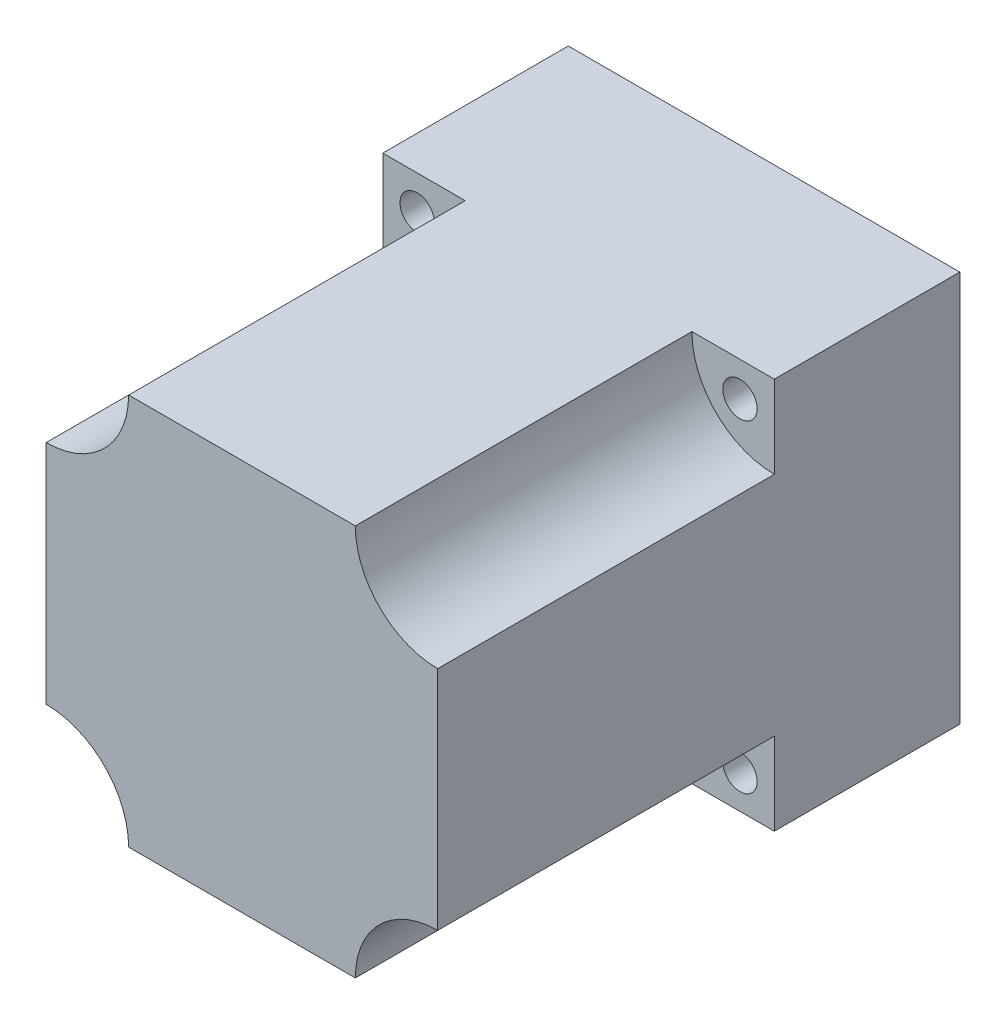
from build123d import *

# Parameters (mm, degrees)
SKETCH_1_W          = 57
SKETCH_1_H          = 57
EXTRUDE_1_DEPTH     = 76
SKETCH_2_R          = 12
CUT_EXTRUDE_1_DEPTH = 49
SKETCH_3_R          = 2.5
CUT_EXTRUDE_2_DEPTH = 87.026158812
SKETCH_4_R          = 19
EXTRUDE_2_DEPTH     = 1.6
SKETCH_5_R          = 4
EXTRUDE_3_DEPTH     = 18.4
SKETCH_6_W          = 13.034699884
SKETCH_6_H          = 1
CUT_EXTRUDE_3_DEPTH = 15


with BuildPart() as part:
    # 草图1 → 凸台-拉伸1 (new body)
    with BuildSketch(Plane.XY):
        Rectangle(SKETCH_1_W, SKETCH_1_H)
    extrude(amount=EXTRUDE_1_DEPTH)

    # 草图2 → 切除-拉伸1 (cut)
    with BuildSketch(Plane.XY.offset(76)):
        with Locations((-28.5, 28.5)):
            Circle(SKETCH_2_R)
        with Locations((28.5, 28.5)):
            Circle(SKETCH_2_R)
        with Locations((-28.5, -28.5)):
            Circle(SKETCH_2_R)
        with Locations((28.5, -28.5)):
            Circle(SKETCH_2_R)
    extrude(amount=-CUT_EXTRUDE_1_DEPTH, mode=Mode.SUBTRACT)

    # 草图3 → 切除-拉伸2 (cut, through all)
    with BuildSketch(Plane(origin=(0, 0, 0), x_dir=(-1, 0, 0), z_dir=(0, 0, -1))):
        with Locations((-23.5, 23.5)):
            Circle(SKETCH_3_R)
        with Locations((23.5, 23.5)):
            Circle(SKETCH_3_R)
        with Locations((-23.5, -23.5)):
            Circle(SKETCH_3_R)
        with Locations((23.5, -23.5)):
            Circle(SKETCH_3_R)
    extrude(amount=-CUT_EXTRUDE_2_DEPTH, mode=Mode.SUBTRACT)

    # 草图4 → 凸台-拉伸2 (add)
    with BuildSketch(Plane(origin=(0, 0, 0), x_dir=(-1, 0, 0), z_dir=(0, 0, -1))):
        Circle(SKETCH_4_R)
    extrude(amount=EXTRUDE_2_DEPTH)

    # 草图5 → 凸台-拉伸3 (add)
    with BuildSketch(Plane(origin=(0, 0, -1.6), x_dir=(-1, 0, 0), z_dir=(0, 0, -1))):
        Circle(SKETCH_5_R)
    extrude(amount=EXTRUDE_3_DEPTH)

    # 草图6 → 切除-拉伸3 (cut)
    with BuildSketch(Plane(origin=(0, 0, -20), x_dir=(-1, 0, 0), z_dir=(0, 0, -1))):
        with Locations((0, 4)):
            Rectangle(SKETCH_6_W, SKETCH_6_H)
    extrude(amount=-CUT_EXTRUDE_3_DEPTH, mode=Mode.SUBTRACT)


solid = part.part
